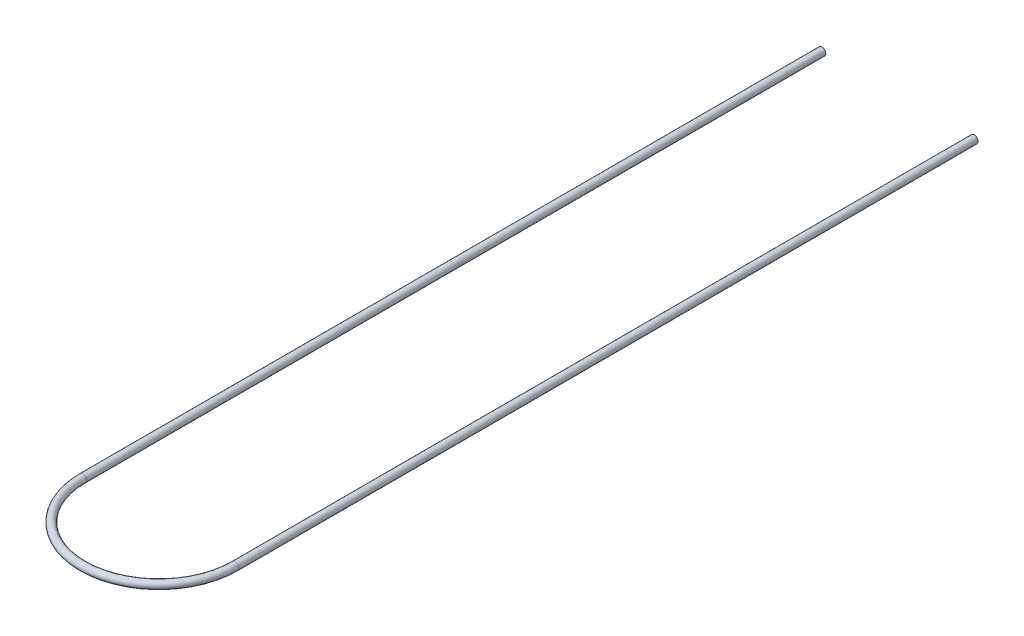
from build123d import *

# Parameters (mm, degrees)
SKETCH2_R   = 11.1
SKETCH2_R_2 = 9.95


with BuildPart() as part:
    # Sweep1: sweep along a path in Sketch1
    with BuildLine(Plane(origin=(0, 0, 0), x_dir=(1, 0, 0), z_dir=(0, 1, 0))) as sweep1_path:
        Line((400.62, -300), (400.62, -2440))
        ThreePointArc((400.62, -2440), (180.31, -2660.31), (-40, -2440))
        Line((-40, -2440), (-40, -300))
    # Sketch2 → Sweep1 (sweep)
    with BuildSketch(Plane(origin=(400.62, 0, 300), x_dir=(-1, 0, 0), z_dir=(0, 0, -1))):
        Circle(SKETCH2_R)
        Circle(SKETCH2_R_2, mode=Mode.SUBTRACT)
    sweep(path=sweep1_path.line)


solid = part.part
